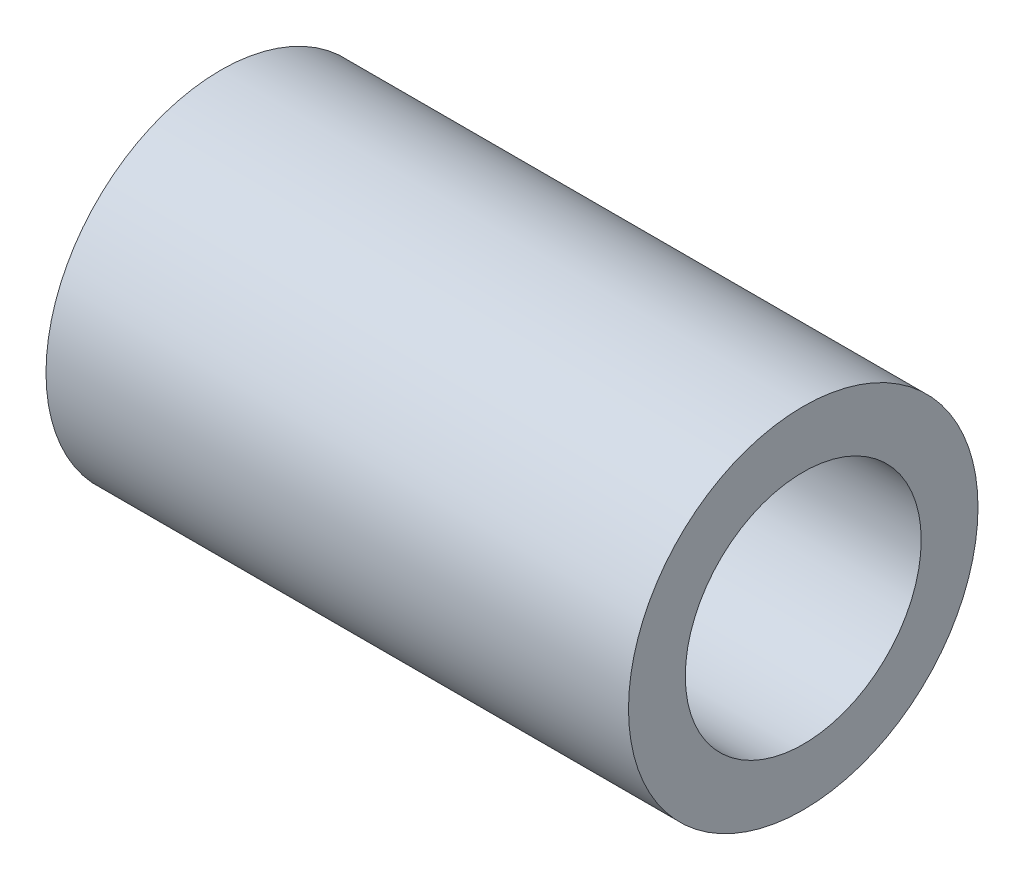
from build123d import *

# Parameters (mm, degrees)
ACETAL_GUIDE_SLEEVE_OUTSIDE_SKETCH_R = 6
ACETAL_GUIDE_SLEEVE_OUTSIDE_DEPTH    = 20
ACETAL_GUIDE_SLEEVE_BORE_SKETCH_R    = 4.05
ACETAL_GUIDE_SLEEVE_BORE_DEPTH       = 20.2


with BuildPart() as part:
    # Acetal guide sleeve outside sketch → Acetal guide sleeve outside (new body)
    with BuildSketch(Plane(origin=(28.708348754, 0, 0), x_dir=(0, 0, -1), z_dir=(1, 0, 0))):
        with Locations((28, -9)):
            Circle(ACETAL_GUIDE_SLEEVE_OUTSIDE_SKETCH_R)
    extrude(amount=ACETAL_GUIDE_SLEEVE_OUTSIDE_DEPTH)

    # Acetal guide sleeve bore sketch → Acetal guide sleeve bore (cut)
    with BuildSketch(Plane(origin=(28.608348754, 0, 0), x_dir=(0, 0, -1), z_dir=(1, 0, 0))):
        with Locations((28, -9)):
            Circle(ACETAL_GUIDE_SLEEVE_BORE_SKETCH_R)
    extrude(amount=ACETAL_GUIDE_SLEEVE_BORE_DEPTH, mode=Mode.SUBTRACT)


solid = part.part
